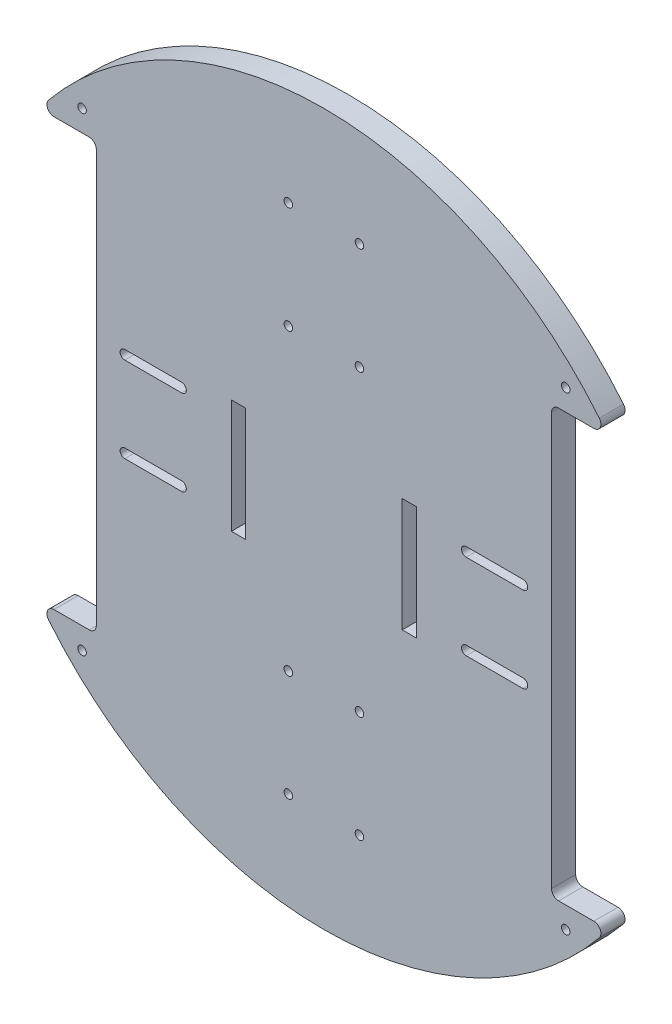
from build123d import *

# Parameters (mm, degrees)
ESTRUSIONE_ESTRUSIONE1_DEPTH = 17
TAGLIO_ESTRUSIONE1_DEPTH     = 321.60723635
RACCORDO1_R                  = 5
SCHIZZO3_R                   = 3
TAGLIO_ESTRUSIONE2_DEPTH     = 318.350542139
SCHIZZO4_W                   = 10
SCHIZZO4_H                   = 80
TAGLIO_ESTRUSIONE4_DEPTH     = 318.350542139
SCHIZZO5_R                   = 3
TAGLIO_ESTRUSIONE5_DEPTH     = 318.350542139


with BuildPart() as part:
    # Schizzo1 → Estrusione-Estrusione1 (new body)
    with BuildSketch(Plane.XY):
        with BuildLine():
            Line((160, 150), (200, 150))
            ThreePointArc((200, 150), (0, 250), (-200, 150))
            Line((-200, 150), (-160, 150))
            Line((-160, 150), (-160, -150))
            Line((-160, -150), (-200, -150))
            ThreePointArc((-200, -150), (0, -250), (200, -150))
            Line((200, -150), (160, -150))
            Line((160, -150), (160, 150))
        make_face()
    extrude(amount=ESTRUSIONE_ESTRUSIONE1_DEPTH)

    # Schizzo2 → Taglio-Estrusione1 (cut, through all)
    with BuildSketch(Plane.XY.offset(17)):
        with BuildLine():
            Line((-140, 33.25), (-100, 33.25))
            ThreePointArc((-100, 33.25), (-96.75, 30), (-100, 26.75))
            Line((-100, 26.75), (-140, 26.75))
            ThreePointArc((-140, 26.75), (-143.25, 30), (-140, 33.25))
        make_face()
        with BuildLine():
            Line((-140, -33.25), (-100, -33.25))
            ThreePointArc((-100, -33.25), (-96.75, -30), (-100, -26.75))
            Line((-100, -26.75), (-140, -26.75))
            ThreePointArc((-140, -26.75), (-143.25, -30), (-140, -33.25))
        make_face()
        with BuildLine():
            Line((140, -33.25), (100, -33.25))
            ThreePointArc((100, -33.25), (96.75, -30), (100, -26.75))
            Line((100, -26.75), (140, -26.75))
            ThreePointArc((140, -26.75), (143.25, -30), (140, -33.25))
        make_face()
        with BuildLine():
            Line((140, 33.25), (100, 33.25))
            ThreePointArc((100, 33.25), (96.75, 30), (100, 26.75))
            Line((100, 26.75), (140, 26.75))
            ThreePointArc((140, 26.75), (143.25, 30), (140, 33.25))
        make_face()
    extrude(amount=-TAGLIO_ESTRUSIONE1_DEPTH, mode=Mode.SUBTRACT)

    # Raccordo1
    raccordo1_edges = [part.edges().sort_by_distance(p)[0] for p in [
        (160, 150, 8.5),
        (160, -150, 8.5),
        (200, -150, 8.5),
        (-200, -150, 8.5),
        (-160, -150, 8.5),
        (-160, 150, 8.5),
        (-200, 150, 8.5),
        (200, 150, 8.5),
    ]]
    fillet(raccordo1_edges, radius=RACCORDO1_R)

    # Schizzo3 → Taglio-Estrusione2 (cut, through all)
    with BuildSketch(Plane(origin=(0, 0, 0), x_dir=(-1, 0, 0), z_dir=(0, 0, -1))):
        with Locations((-25, 180)):
            Circle(SCHIZZO3_R)
        with Locations(Location((25, 180, 0), (0, 0, 180))):
            Circle(SCHIZZO3_R)
        with Locations((-25, 105)):
            Circle(SCHIZZO3_R)
        with Locations((25, 105)):
            Circle(SCHIZZO3_R)
        with Locations(Location((-25, -105, 0), (0, 0, 180))):
            Circle(SCHIZZO3_R)
        with Locations(Location((25, -105, 0), (0, 0, 180))):
            Circle(SCHIZZO3_R)
        with Locations((25, -180)):
            Circle(SCHIZZO3_R)
        with Locations(Location((-25, -180, 0), (0, 0, 180))):
            Circle(SCHIZZO3_R)
    extrude(amount=-TAGLIO_ESTRUSIONE2_DEPTH, mode=Mode.SUBTRACT)

    # Schizzo4 → Taglio-Estrusione4 (cut, through all)
    with BuildSketch(Plane(origin=(0, 0, 0), x_dir=(-1, 0, 0), z_dir=(0, 0, -1))):
        with Locations((-60, 0)):
            Rectangle(SCHIZZO4_W, SCHIZZO4_H)
        with Locations((60, 0)):
            Rectangle(SCHIZZO4_W, SCHIZZO4_H)
    extrude(amount=-TAGLIO_ESTRUSIONE4_DEPTH, mode=Mode.SUBTRACT)

    # Schizzo5 → Taglio-Estrusione5 (cut, through all)
    with BuildSketch(Plane(origin=(0, 0, 0), x_dir=(-1, 0, 0), z_dir=(0, 0, -1))):
        with Locations((-170, 165)):
            Circle(SCHIZZO5_R)
        with Locations(Location((170, 165, 0), (0, 0, 180))):
            Circle(SCHIZZO5_R)
        with Locations((170, -165)):
            Circle(SCHIZZO5_R)
        with Locations(Location((-170, -165, 0), (0, 0, 180))):
            Circle(SCHIZZO5_R)
    extrude(amount=-TAGLIO_ESTRUSIONE5_DEPTH, mode=Mode.SUBTRACT)


solid = part.part
